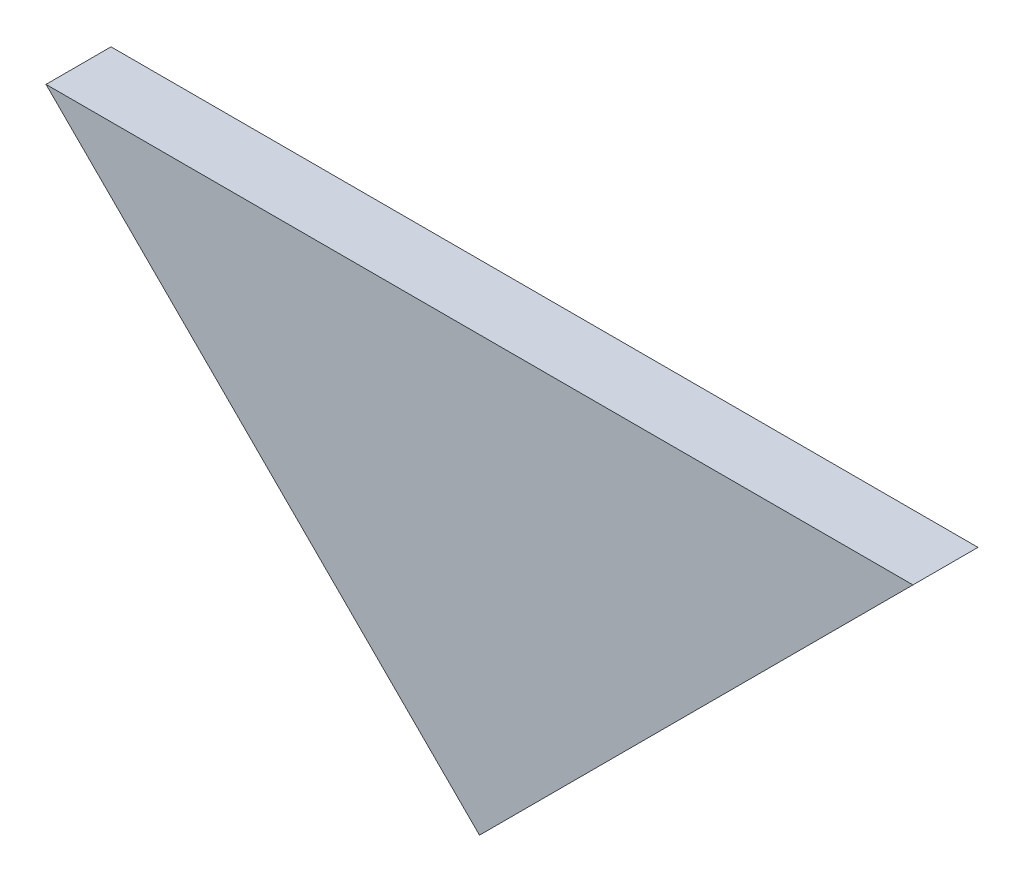
from build123d import *

# Parameters (mm, degrees)
BOSS_EXTRUDE1_DEPTH = 6


with BuildPart() as part:
    # Sketch1 → Boss-Extrude1 (new body)
    with BuildSketch(Plane.XY):
        Polygon((0, 0), (40, 40), (-40, 40), align=None)
    extrude(amount=BOSS_EXTRUDE1_DEPTH)


solid = part.part
